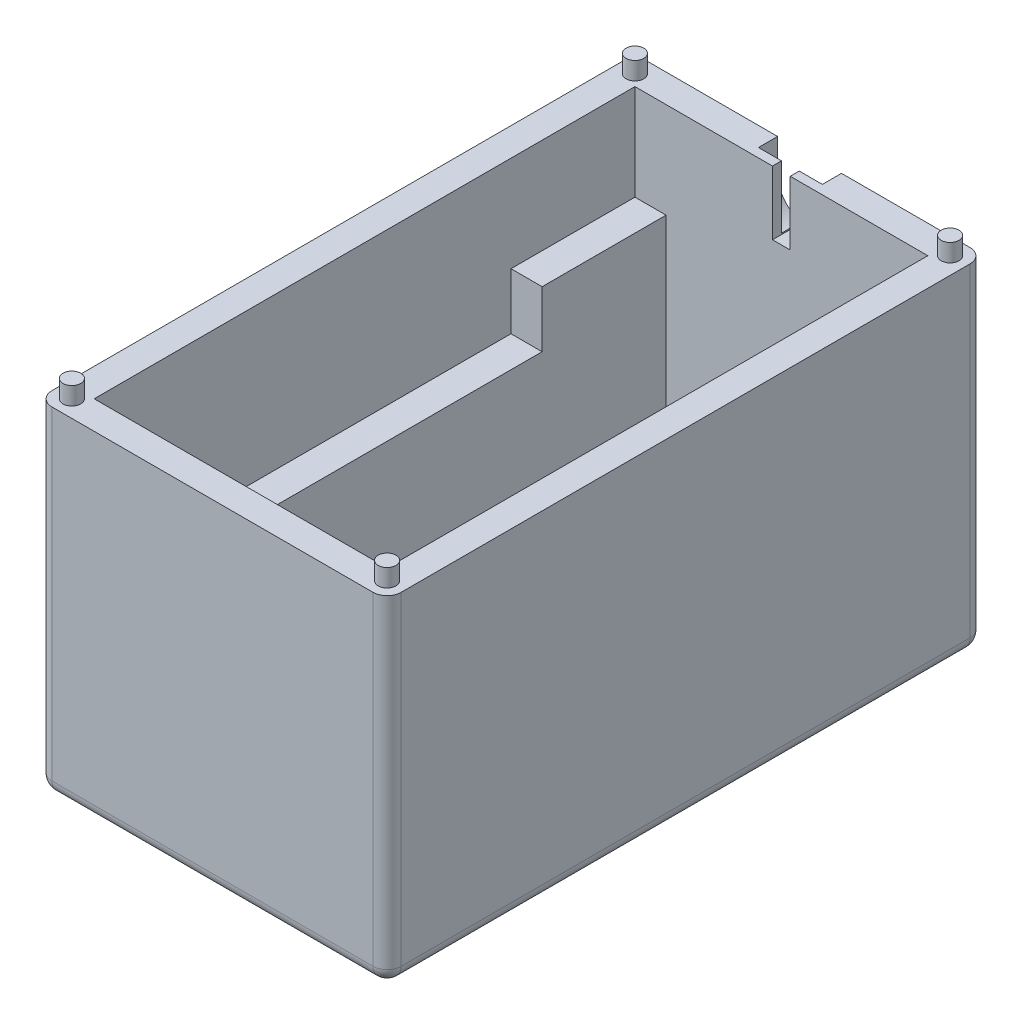
from build123d import *

# Parameters (mm, degrees)
SKETCH1_W                     = 33.02
SKETCH1_H                     = 60.96
BASE_DEPTH                    = 3.175
SKETCH2_W                     = 3.51
SKETCH2_H                     = 60.96
BATTERY_SIDES_DEPTH           = 17.78
SKETCH3_W                     = 39.37
SKETCH3_H                     = 67.31
SKETCH3_W_2                   = 33.02
SKETCH3_H_2                   = 60.96
OUTER_CASING_DEPTH            = 38.1
BATTERY_PUSH_HOLE_REACH       = 56.514
SKETCH4_R                     = 10
FILLET1_R                     = 1.5875
SKETCH5_R                     = 1
ALIGNMENT_PEGS_DEPTH          = 2
ATTACHMENT_NARROW_POINT_REACH = 82.785
SKETCH6_W                     = 2
SKETCH6_H                     = 7.2
CUT_EXTRUDE4_DEPTH            = 2.157
SKETCH9_W                     = 3.51
SKETCH9_H                     = 13.97
BOSS_EXTRUDE5_DEPTH           = 6.35


with BuildPart() as part:
    # Sketch1 → Base (new body)
    with BuildSketch(Plane(origin=(0, 0, 0), x_dir=(1, 0, 0), z_dir=(0, 1, 0))):
        Rectangle(SKETCH1_W, SKETCH1_H)
        Polygon((-16.51, 30.48), (16.51, 30.48), (16.51, -30.48), align=None)
    extrude(amount=BASE_DEPTH)

    # Sketch2 → Battery-Sides (add)
    with BuildSketch(Plane(origin=(0, 3.175, 0), x_dir=(1, 0, 0), z_dir=(0, 1, 0))):
        with Locations((-14.755, 0)):
            Rectangle(SKETCH2_W, SKETCH2_H)
        with Locations((14.755, 0)):
            Rectangle(SKETCH2_W, SKETCH2_H)
    extrude(amount=BATTERY_SIDES_DEPTH)

    # Sketch3 → Outer-Casing (add)
    with BuildSketch(Plane.XZ):
        Rectangle(SKETCH3_W, SKETCH3_H)
        Rectangle(SKETCH3_W_2, SKETCH3_H_2, mode=Mode.SUBTRACT)
    extrude(amount=-OUTER_CASING_DEPTH)

    # Sketch4 → Battery-push-hole (cut, up to next)
    with BuildSketch(Plane.XZ, mode=Mode.PRIVATE) as battery_push_hole_sk1:
        with Locations(Location((0, 0, 0), (0, 0, 270))):
            Circle(SKETCH4_R)
    battery_push_hole_tool1 = extrude(battery_push_hole_sk1.sketch, amount=-BATTERY_PUSH_HOLE_REACH, mode=Mode.PRIVATE) & part.part
    add(battery_push_hole_tool1.solids().sort_by_distance((0, 0, 0))[0], mode=Mode.SUBTRACT)

    # Fillet1
    fillet1_edges = [part.edges().sort_by_distance(p)[0] for p in [
        (19.685, 19.05, 33.655),
        (19.685, 19.05, -33.655),
        (-19.685, 19.05, -33.655),
        (-19.685, 19.05, 33.655),
        (19.685, 0, 0),
        (0, 0, 33.655),
        (-19.685, 0, 0),
        (0, 0, -33.655),
        (0, 0, 10),
    ]]
    fillet(fillet1_edges, radius=FILLET1_R)

    # Sketch5 → Alignment Pegs (add)
    with BuildSketch(Plane(origin=(0, 38.1, 0), x_dir=(1, 0, 0), z_dir=(0, 1, 0))):
        with Locations(Location((-17.767235857, 31.737235857, 0), (0, 0, 90))):
            Circle(SKETCH5_R)
        with Locations(Location((-17.767235857, -31.737235857, 0), (0, 0, 90))):
            Circle(SKETCH5_R)
        with Locations(Location((17.767235857, 31.737235857, 0), (0, 0, 90))):
            Circle(SKETCH5_R)
        with Locations(Location((17.767235857, -31.737235857, 0), (0, 0, 90))):
            Circle(SKETCH5_R)
    extrude(amount=ALIGNMENT_PEGS_DEPTH)

    # Sketch6 → Attachment Narrow Point (cut, up to next)
    with BuildSketch(Plane(origin=(0, 0, -33.655), x_dir=(-1, 0, 0), z_dir=(0, 0, -1)), mode=Mode.PRIVATE) as attachment_narrow_point_sk1:
        with Locations((0, 34.5)):
            Rectangle(SKETCH6_W, SKETCH6_H)
    attachment_narrow_point_tool1 = extrude(attachment_narrow_point_sk1.sketch, amount=-ATTACHMENT_NARROW_POINT_REACH, mode=Mode.PRIVATE) & part.part
    add(attachment_narrow_point_tool1.solids().sort_by_distance((0, 34.5, -33.655))[0], mode=Mode.SUBTRACT)

    # Sketch8 → Cut-Extrude4 (cut)
    with BuildSketch(Plane.XY.offset(-33.655)):
        with BuildLine():
            ThreePointArc((1, 31.041676707), (2.877498914, 32.336669235), (3.6, 34.5))
            Line((3.6, 34.5), (3.6, 38.1))
            Line((3.6, 38.1), (1, 38.1))
            Line((1, 38.1), (1, 37.958323293))
            Line((1, 37.958323293), (1, 31.041676707))
        make_face()
        with BuildLine():
            ThreePointArc((-3.6, 34.5), (-2.877498914, 32.336669235), (-1, 31.041676707))
            Line((-1, 31.041676707), (-1, 37.958323293))
            Line((-1, 37.958323293), (-1, 38.1))
            Line((-1, 38.1), (-3.6, 38.1))
            Line((-3.6, 38.1), (-3.6, 34.5))
        make_face()
    extrude(amount=CUT_EXTRUDE4_DEPTH, mode=Mode.SUBTRACT)

    # Sketch9 → Boss-Extrude5 (add)
    with BuildSketch(Plane(origin=(0, 20.955, 0), x_dir=(1, 0, 0), z_dir=(0, 1, 0))):
        with Locations((-14.755, 23.495)):
            Rectangle(SKETCH9_W, SKETCH9_H)
        with Locations((14.755, 23.495)):
            Rectangle(SKETCH9_W, SKETCH9_H)
    extrude(amount=BOSS_EXTRUDE5_DEPTH)


solid = part.part
